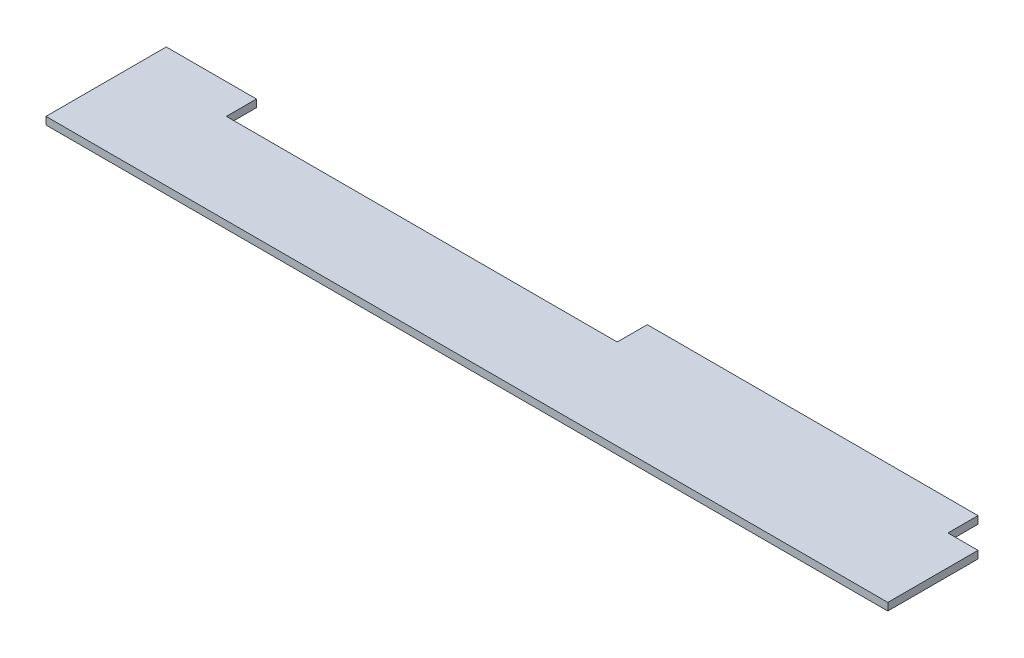
from build123d import *

# Parameters (mm, degrees)
BOSS_EXTRUDE1_DEPTH = 6.35


with BuildPart() as part:
    # Sketch1 → Boss-Extrude1 (new body)
    with BuildSketch(Plane(origin=(0, 0, 0), x_dir=(1, 0, 0), z_dir=(0, 1, 0))):
        Polygon((0, 0), (0, 25.4), (279.4, 25.4), (279.4, 0), (304.8, 0), (304.8, -76.2), (-406.4, -76.2), (-406.4, 25.4), (-330.2, 25.4), (-330.2, 0), align=None)
    extrude(amount=BOSS_EXTRUDE1_DEPTH)


solid = part.part
